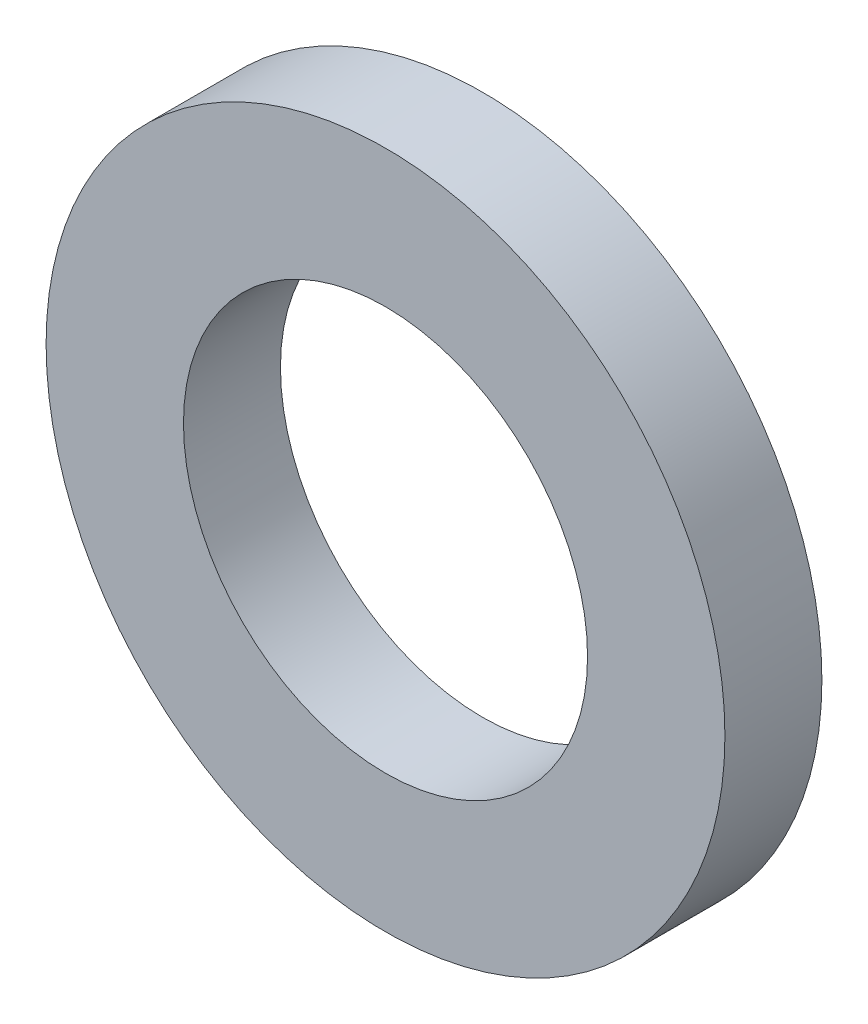
from build123d import *

# Parameters (mm, degrees)
SKETCH1_R           = 21
SKETCH1_R_2         = 12.5
BOSS_EXTRUDE1_DEPTH = 6


with BuildPart() as part:
    # Sketch1 → Boss-Extrude1 (new body)
    with BuildSketch(Plane.XY):
        Circle(SKETCH1_R)
        Circle(SKETCH1_R_2, mode=Mode.SUBTRACT)
    extrude(amount=BOSS_EXTRUDE1_DEPTH)


solid = part.part
